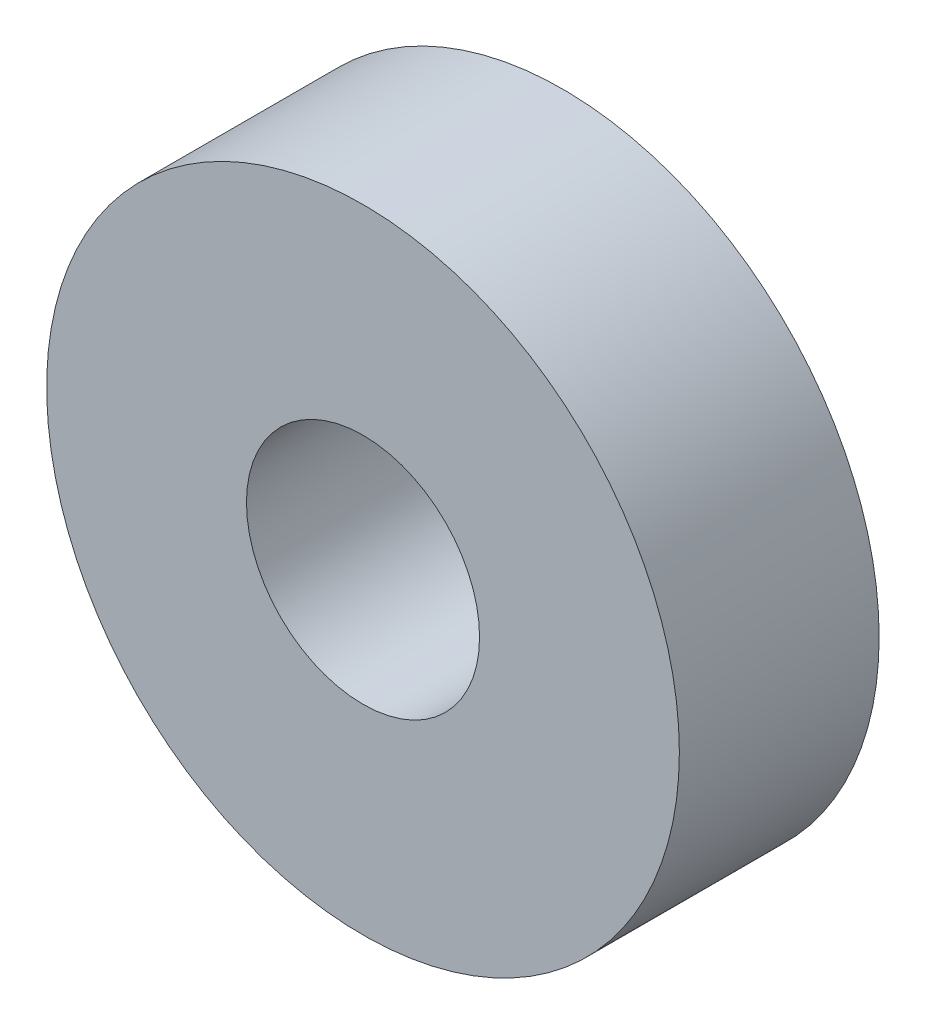
from build123d import *

# Parameters (mm, degrees)
ESQUISSE1_R             = 9.5
BOSS_EXTRU_1_DEPTH      = 6
ENL_V_MAT_EXTRU_1_REACH = 43.876
ESQUISSE2_R             = 3.5


with BuildPart() as part:
    # Esquisse1 → Boss.-Extru.1 (new body)
    with BuildSketch(Plane.XY):
        with Locations((-30.697145843, 0.589360339)):
            Circle(ESQUISSE1_R)
    extrude(amount=BOSS_EXTRU_1_DEPTH)

    # Esquisse2 → Enlèv. mat.-Extru.1 (cut, up to next)
    with BuildSketch(Plane.XY.offset(6), mode=Mode.PRIVATE) as enl_v_mat_extru_1_sk1:
        with Locations((-30.697145843, 0.589360339)):
            Circle(ESQUISSE2_R)
    enl_v_mat_extru_1_tool1 = extrude(enl_v_mat_extru_1_sk1.sketch, amount=-ENL_V_MAT_EXTRU_1_REACH, mode=Mode.PRIVATE) & part.part
    add(enl_v_mat_extru_1_tool1.solids().sort_by_distance((-30.697146, 0.58936, 6))[0], mode=Mode.SUBTRACT)


solid = part.part
